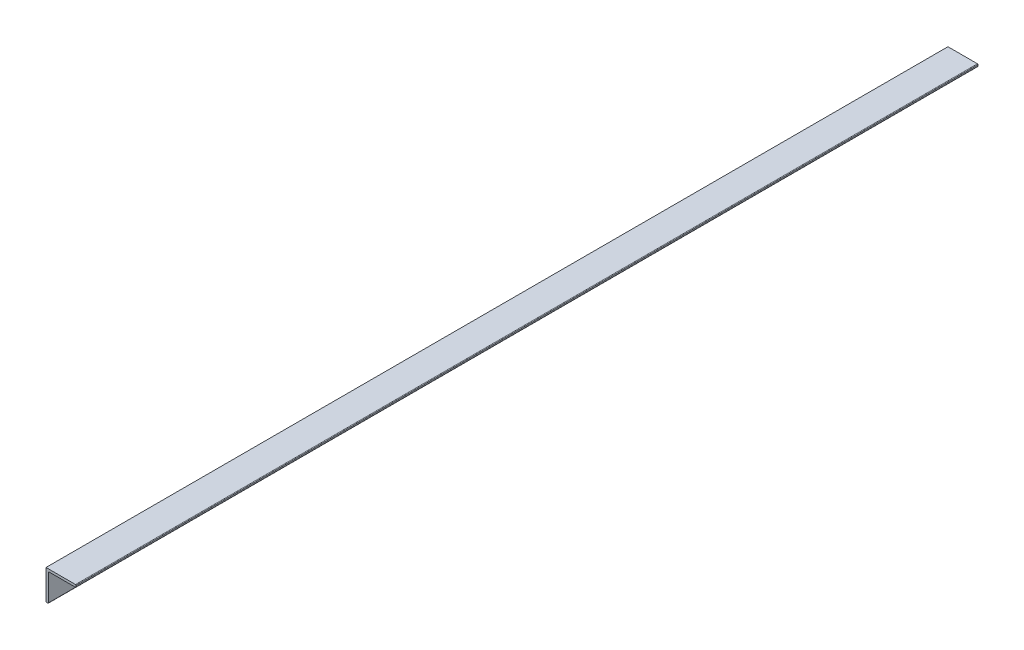
from build123d import *

# Parameters (mm, degrees)
EXTRUDE_1_DEPTH = 750


with BuildPart() as part:
    # Эскиз1 → Бобышка-Вытянуть1 (new body)
    with BuildSketch(Plane.XY):
        with BuildLine():
            Line((10, 14.5), (10, 13.5))
            ThreePointArc((10, 13.5), (9.853553391, 13.146446609), (9.5, 13))
            Line((9.5, 13), (-12.5, 13))
            ThreePointArc((-12.5, 13), (-12.853553391, 12.853553391), (-13, 12.5))
            Line((-13, 12.5), (-13, -9.5))
            ThreePointArc((-13, -9.5), (-13.146446609, -9.853553391), (-13.5, -10))
            Line((-13.5, -10), (-14.5, -10))
            ThreePointArc((-14.5, -10), (-14.853553391, -9.853553391), (-15, -9.5))
            Line((-15, -9.5), (-15, 15))
            Line((-15, 15), (9.5, 15))
            ThreePointArc((9.5, 15), (9.853553391, 14.853553391), (10, 14.5))
        make_face()
    extrude(amount=EXTRUDE_1_DEPTH)


solid = part.part
